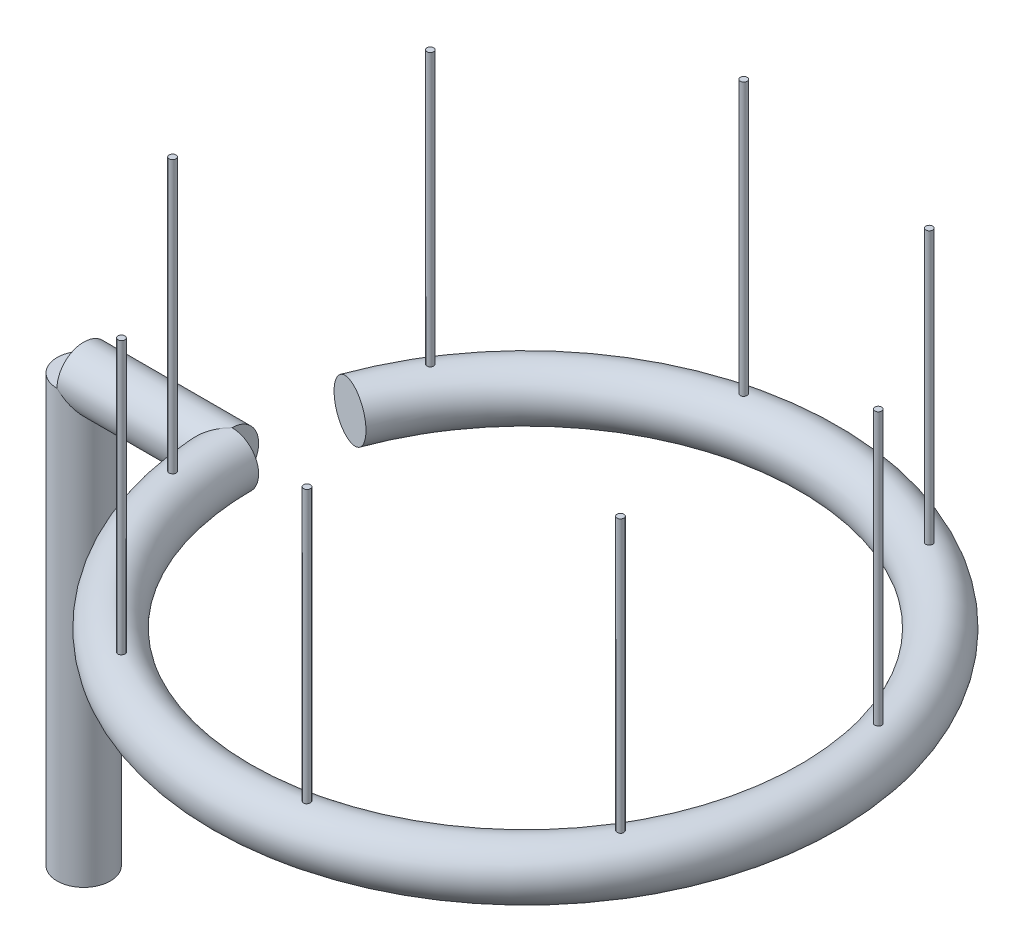
from build123d import *

# Parameters (mm, degrees)
SKETCH1_R           = 3.175
REVOLVE1_ANGLE      = 340
SKETCH2_R           = 0.409575
BOSS_EXTRUDE1_DEPTH = 35.56
CIRPATTERN1_COUNT   = 8
SKETCH7_R           = 3.175
BOSS_EXTRUDE2_DEPTH = 17.653
SKETCH10_R          = 3.175
BOSS_EXTRUDE3_DEPTH = 50.8


with BuildPart() as part:
    # Sketch1 → Revolve1 (revolve)
    with BuildSketch(Plane.XY):
        with Locations((-34.925, 0)):
            Circle(SKETCH1_R)
    revolve(axis=Axis((0, 0, 0), (0, 1, 0)), revolution_arc=REVOLVE1_ANGLE)

    # Sketch2 → Boss-Extrude1 (add)
    with BuildSketch(Plane(origin=(0, 0, 0), x_dir=(1, 0, 0), z_dir=(0, 1, 0))):
        with Locations(Location((-29.697367501, 18.379934399, 0), (0, 0, 135.804217831))):
            Circle(SKETCH2_R)
    boss_extrude1 = extrude(amount=BOSS_EXTRUDE1_DEPTH)

    # CirPattern1: Boss-Extrude1 ×8 about axis
    cirpattern1_axis = Axis((0, 0, 0), (0, 1, 0))
    for i in range(1, CIRPATTERN1_COUNT):
        add(boss_extrude1.rotate(cirpattern1_axis, i * 360 / CIRPATTERN1_COUNT))

    # Sketch7 → Boss-Extrude2 (add)
    with BuildSketch(Plane(origin=(-34.925, 0, 0), x_dir=(0, 1, 0), z_dir=(-1, 0, 0))):
        with Locations(Location((0, 0, 0), (0, 0, 180))):
            Circle(SKETCH7_R)
    extrude(amount=BOSS_EXTRUDE2_DEPTH)

    # Sketch10 → Boss-Extrude3 (add)
    with BuildSketch(Plane(origin=(0, 0, 0), x_dir=(0, 0, -1), z_dir=(0, 1, 0))):
        with Locations(Location((0, 52.578, 0), (0, 0, 180))):
            Circle(SKETCH10_R)
    extrude(amount=-BOSS_EXTRUDE3_DEPTH)


solid = part.part
